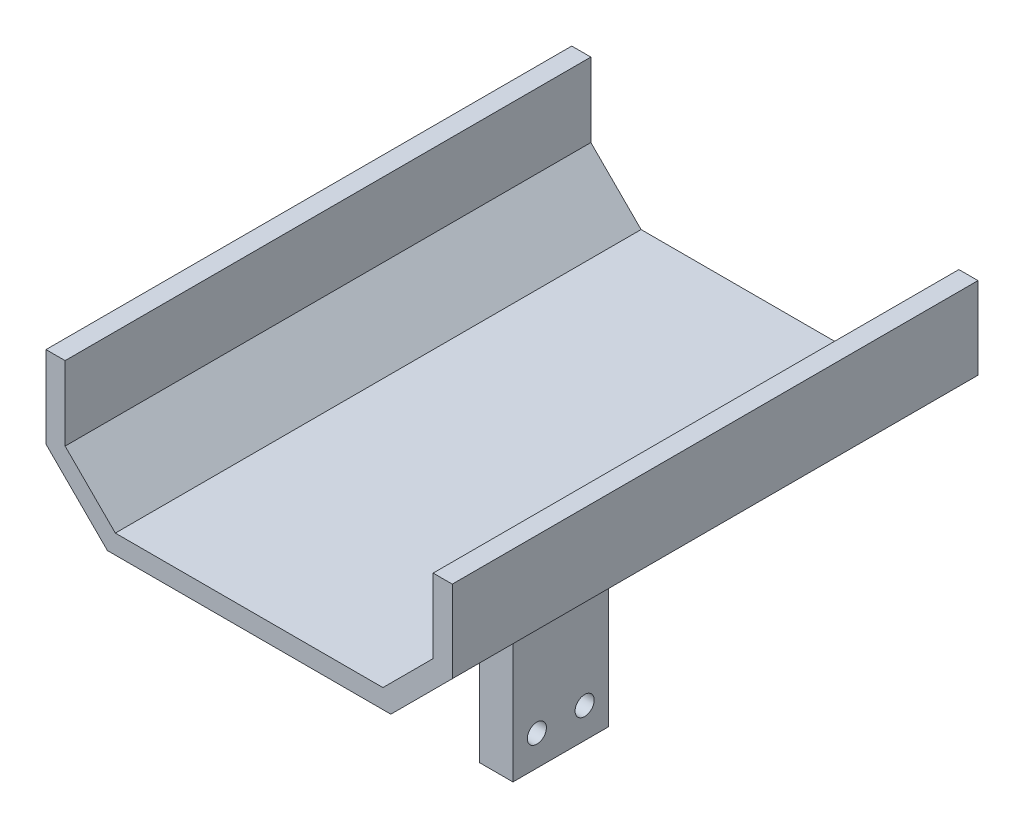
from build123d import *

# Parameters (mm, degrees)
BOSS_EXTRUDE1_DEPTH     = 110
BOSS_EXTRUDE2_REACH     = 144.215
SKETCH2_W               = 7
SKETCH2_H               = 20
SKETCH4_W               = 7
SKETCH4_H               = 20
BOSS_EXTRUDE3_DEPTH     = 14.5
CUT_EXTRUDE1_DEPTH      = 145.066443005
CUT_EXTRUDE1_DEPTH_BACK = 145.066443005
SKETCH5_R               = 2


with BuildPart() as part:
    # Sketch1 → Boss-Extrude1 (new body)
    with BuildSketch(Plane.XY):
        Polygon((0, 0), (0, -17.14826885), (12.85173115, -30), (72.14826885, -30), (85, -17.14826885), (85, 0), (81, 0), (81, -15.4914146), (70.4914146, -26), (14.5085854, -26), (4, -15.4914146), (4, 0), align=None)
    extrude(amount=BOSS_EXTRUDE1_DEPTH)

    # Sketch2 → Boss-Extrude2 (add, up to next)
    with BuildSketch(Plane.XZ.offset(30), mode=Mode.PRIVATE) as boss_extrude2_sk1:
        with Locations((6.8, 25)):
            Rectangle(SKETCH2_W, SKETCH2_H)
    boss_extrude2_tool1 = extrude(boss_extrude2_sk1.sketch, amount=-BOSS_EXTRUDE2_REACH, mode=Mode.PRIVATE) - part.part
    # Sketch2 → Boss-Extrude2 (add, up to next)
    with BuildSketch(Plane.XZ.offset(30), mode=Mode.PRIVATE) as boss_extrude2_sk2:
        with Locations((79.2, 85)):
            Rectangle(SKETCH2_W, SKETCH2_H)
    boss_extrude2_tool2 = extrude(boss_extrude2_sk2.sketch, amount=-BOSS_EXTRUDE2_REACH, mode=Mode.PRIVATE) - part.part
    add(boss_extrude2_tool1.solids().sort_by_distance((6.8, -30, 25))[0])
    add(boss_extrude2_tool2.solids().sort_by_distance((79.2, -30, 85))[0])

    # Sketch4 → Boss-Extrude3 (add)
    with BuildSketch(Plane.XZ.offset(30)):
        with Locations((6.8, 25)):
            Rectangle(SKETCH4_W, SKETCH4_H)
        with Locations((79.2, 85)):
            Rectangle(SKETCH4_W, SKETCH4_H)
    extrude(amount=BOSS_EXTRUDE3_DEPTH)

    # Sketch5 → Cut-Extrude1 (cut, two sides: drawn at the far end of the back side and taken through both)
    with BuildSketch(Plane.ZY.offset(-3.3).offset(-CUT_EXTRUDE1_DEPTH_BACK)):
        with Locations((20, -38.15)):
            Circle(SKETCH5_R)
        with Locations((30, -38.15)):
            Circle(SKETCH5_R)
        with Locations((80, -38.15)):
            Circle(SKETCH5_R)
        with Locations((90, -38.15)):
            Circle(SKETCH5_R)
    extrude(amount=CUT_EXTRUDE1_DEPTH + CUT_EXTRUDE1_DEPTH_BACK, mode=Mode.SUBTRACT)


solid = part.part
